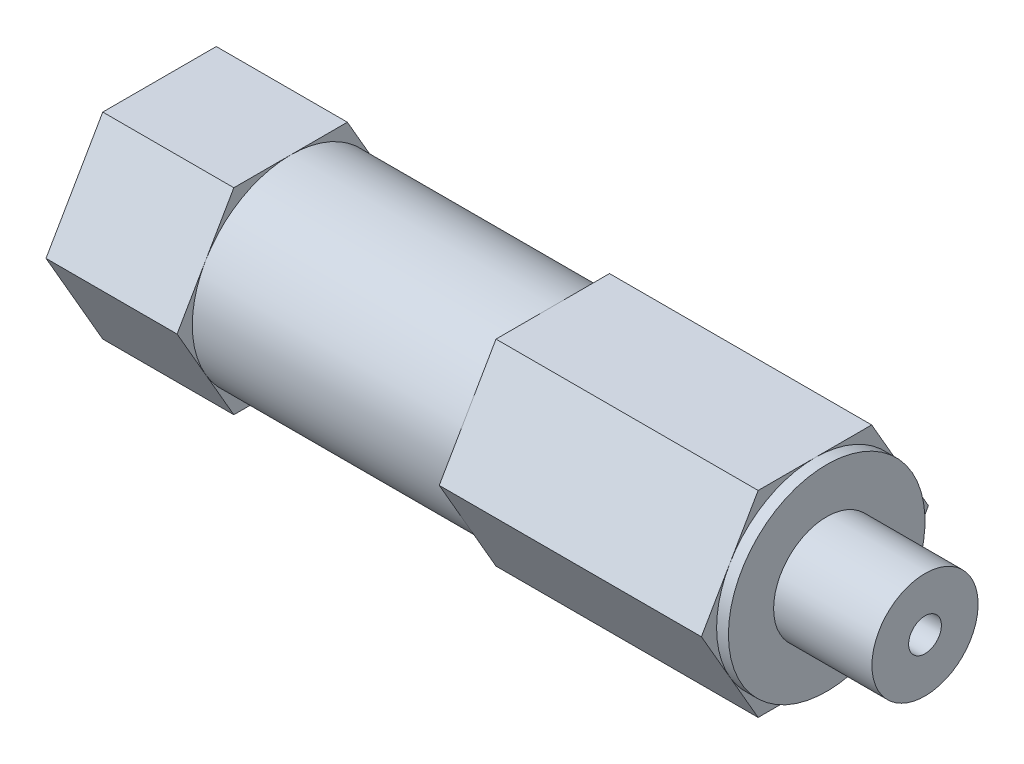
from build123d import *

# Parameters (mm, degrees)
BOSS_EXTRUDE1_START = -12.7
BOSS_EXTRUDE1_DEPTH = 12.7
BOSS_EXTRUDE2_START = -63.5
BOSS_EXTRUDE2_DEPTH = 25.4


with BuildPart() as part:
    # Sketch1 → Revolve1 (revolve)
    with BuildSketch(Plane.XY):
        Polygon((0, 9.525), (64.643, 9.525), (64.643, 5.1435), (74.168, 5.1435), (74.168, 1.5875), (59.77878359, 1.5875), (59.77878359, 4.58916283), (40.457949701, 4.58916283), (40.457949701, 7.536935058), (36.795436007, 7.536935058), (36.795436007, 5.555870047), (31.917498279, 2.413), (25.308223812, 2.413), (23.794433849, 4.7625), (0, 4.7625), align=None)
    revolve(axis=Axis((0, 0, 0), (1, 0, 0)))

    # Sketch8 → Boss-Extrude1 (add)
    with BuildSketch(Plane.ZY.offset(BOSS_EXTRUDE1_START)):
        with BuildLine():
            Line((-8.248892028, 4.762499902), (-10.998522628, 0))
            Line((-10.998522628, 0), (-8.248891917, -4.762500094))
            ThreePointArc((-8.248891917, -4.762500094), (-9.525, -1.11e-07), (-8.248892028, 4.762499902))
        make_face()
        with BuildLine():
            ThreePointArc((0, -9.525), (-4.762499953, -8.248891998), (-8.248891917, -4.762500094))
            Line((-8.248891917, -4.762500094), (-5.499261314, -9.525))
            Line((-5.499261314, -9.525), (0, -9.525))
        make_face()
        with BuildLine():
            Line((-5.499261314, 9.525), (-8.248892028, 4.762499902))
            ThreePointArc((-8.248892028, 4.762499902), (-4.762500049, 8.248891943), (0, 9.525))
            Line((0, 9.525), (-5.499261314, 9.525))
        make_face()
        with BuildLine():
            ThreePointArc((8.248891846, -4.762500216), (4.762499892, -8.248892033), (0, -9.525))
            Line((0, -9.525), (5.499261314, -9.525))
            Line((5.499261314, -9.525), (8.248891846, -4.762500216))
        make_face()
        with BuildLine():
            Line((5.499261314, 9.525), (0, 9.525))
            ThreePointArc((0, 9.525), (4.762499953, 8.248891998), (8.248891917, 4.762500094))
            Line((8.248891917, 4.762500094), (5.499261314, 9.525))
        make_face()
        with BuildLine():
            ThreePointArc((8.248891917, 4.762500094), (9.525, -7.1e-08), (8.248891846, -4.762500216))
            Line((8.248891846, -4.762500216), (10.998522628, 0))
            Line((10.998522628, 0), (8.248891917, 4.762500094))
        make_face()
    extrude(amount=BOSS_EXTRUDE1_DEPTH)

    # Sketch8<3> → Boss-Extrude2 (add)
    with BuildSketch(Plane.ZY.offset(BOSS_EXTRUDE2_START)):
        with BuildLine():
            Line((-8.248892028, 4.762499902), (-10.998522628, 0))
            Line((-10.998522628, 0), (-8.248891917, -4.762500094))
            ThreePointArc((-8.248891917, -4.762500094), (-9.525, -1.11e-07), (-8.248892028, 4.762499902))
        make_face()
        with BuildLine():
            ThreePointArc((0, -9.525), (-4.762499953, -8.248891998), (-8.248891917, -4.762500094))
            Line((-8.248891917, -4.762500094), (-5.499261314, -9.525))
            Line((-5.499261314, -9.525), (0, -9.525))
        make_face()
        with BuildLine():
            Line((-5.499261314, 9.525), (-8.248892028, 4.762499902))
            ThreePointArc((-8.248892028, 4.762499902), (-4.762500049, 8.248891943), (0, 9.525))
            Line((0, 9.525), (-5.499261314, 9.525))
        make_face()
        with BuildLine():
            ThreePointArc((8.248891846, -4.762500216), (4.762499892, -8.248892033), (0, -9.525))
            Line((0, -9.525), (5.499261314, -9.525))
            Line((5.499261314, -9.525), (8.248891846, -4.762500216))
        make_face()
        with BuildLine():
            Line((5.499261314, 9.525), (0, 9.525))
            ThreePointArc((0, 9.525), (4.762499953, 8.248891998), (8.248891917, 4.762500094))
            Line((8.248891917, 4.762500094), (5.499261314, 9.525))
        make_face()
        with BuildLine():
            ThreePointArc((8.248891917, 4.762500094), (9.525, -7.1e-08), (8.248891846, -4.762500216))
            Line((8.248891846, -4.762500216), (10.998522628, 0))
            Line((10.998522628, 0), (8.248891917, 4.762500094))
        make_face()
    extrude(amount=BOSS_EXTRUDE2_DEPTH)


solid = part.part
